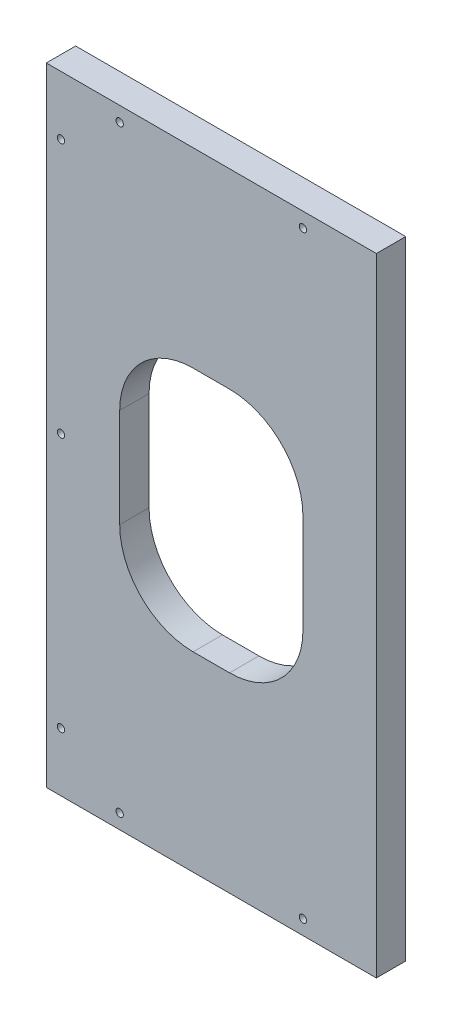
from build123d import *

# Parameters (mm, degrees)
SKETCH1_W           = 142.755639788
SKETCH1_H           = 271.365530146
BOSS_EXTRUDE1_DEPTH = 12.7
HOLE1_D             = 3.175
HOLE1_DEPTH         = 31.75
HOLE1_CSINK_D       = 10.16
HOLE1_CSINK_ANGLE   = 82
HOLE1_TIP           = 0.953866233
SKETCH4_W           = 79.255639788
SKETCH4_H           = 106.265530146
CUT_EXTRUDE1_DEPTH  = 302.349406056
FILLET1_R           = 31.75


with BuildPart() as part:
    # Sketch1 → Boss-Extrude1 (new body)
    with BuildSketch(Plane.XY):
        with Locations((-163.375147287, -52.841023691)):
            Rectangle(SKETCH1_W, SKETCH1_H)
    extrude(amount=BOSS_EXTRUDE1_DEPTH)

    # Hole1
    with Locations(Plane(origin=(181.039434513, -52.974999997, 0), x_dir=(0, -1, 0), z_dir=(0, 0, -1))):
        with Locations((129.198788767, 384.042401694), (-129.466741379, 384.042401694), (-129.466741379, 304.786761906), (-110.416741379, 409.442401694), (-0.133976306, 409.442401694), (110.148788767, 409.442401694), (129.198788767, 304.786761906)):
            CounterSinkHole(HOLE1_D / 2, HOLE1_CSINK_D / 2, depth=HOLE1_DEPTH, counter_sink_angle=HOLE1_CSINK_ANGLE)
            with Locations((0, 0, -(HOLE1_DEPTH + HOLE1_TIP / 2))):  # 118° drill point
                Cone(0, HOLE1_D / 2, HOLE1_TIP, mode=Mode.SUBTRACT)

    # Sketch4 → Cut-Extrude1 (cut, through all)
    with BuildSketch(Plane.XY.offset(12.7)):
        with Locations((-163.375147287, -52.841023691)):
            Rectangle(SKETCH4_W, SKETCH4_H)
    extrude(amount=-CUT_EXTRUDE1_DEPTH, mode=Mode.SUBTRACT)

    # Fillet1
    fillet1_edges = [part.edges().sort_by_distance(p)[0] for p in [
        (-203.002967181, -105.973788764, 6.35),
        (-203.002967181, 0.291741382, 6.35),
        (-123.747327393, 0.291741382, 6.35),
        (-123.747327393, -105.973788764, 6.35),
    ]]
    fillet(fillet1_edges, radius=FILLET1_R)


solid = part.part
